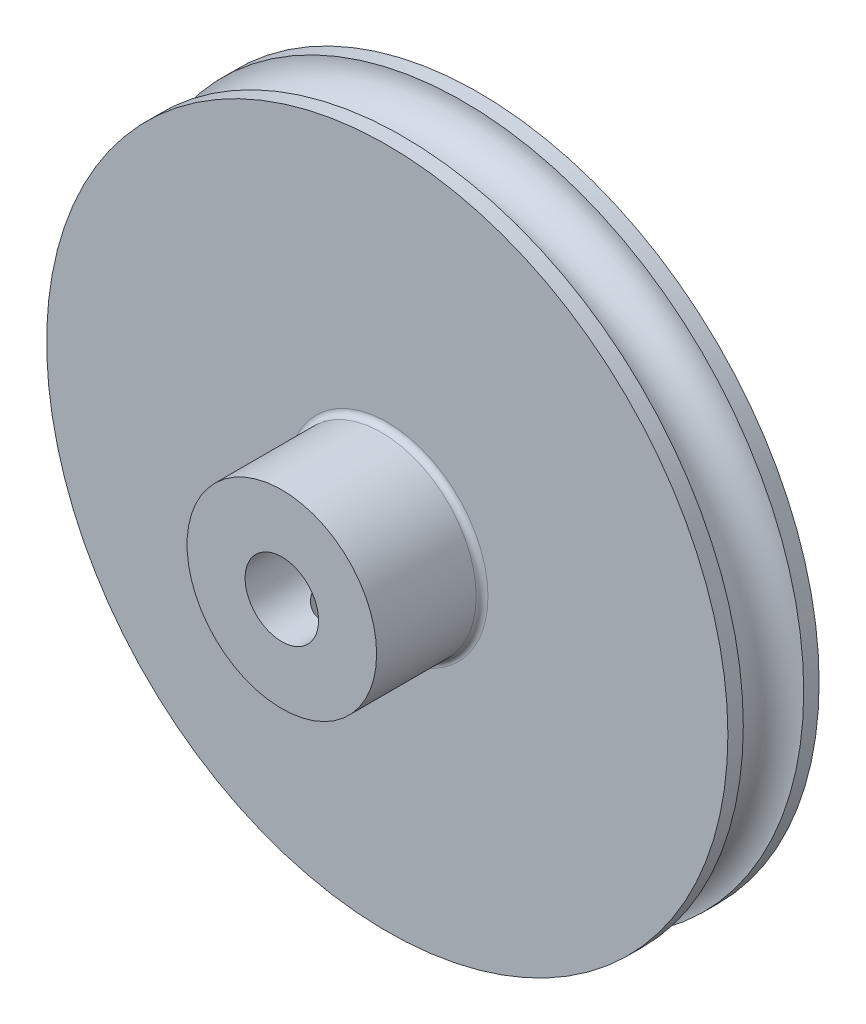
from build123d import *

# Parameters (mm, degrees)
SKETCH1_R           = 28.75
BOSS_EXTRUDE1_DEPTH = 3.85
SKETCH2_R           = 2.55
SKETCH4_R           = 8
BOSS_EXTRUDE2_DEPTH = 8.9
SKETCH5_R           = 3.1
CUT_EXTRUDE1_DEPTH  = 15.6
SKETCH6_R           = 2
CUT_EXTRUDE2_DEPTH  = 43.61088476
FILLET1_R           = 0.5


with BuildPart() as part:
    # Sketch1 → Boss-Extrude1 (new, symmetric)
    with BuildSketch(Plane.XY):
        with Locations(Location((0, 0, 0), (0, 0, 180))):
            Circle(SKETCH1_R)
    extrude(amount=BOSS_EXTRUDE1_DEPTH, both=True)

    # Cut-Sweep1: sweep along a curve in space
    with BuildLine() as cut_sweep1_path:
        ThreePointArc((28.75, 0, -3.85), (20.329319959, 20.329319959, -3.85), (0, 28.75, -3.85))
        ThreePointArc((0, 28.75, -3.85), (-20.329319959, 20.329319959, -3.85), (-28.75, 0, -3.85))
        ThreePointArc((-28.75, 0, -3.85), (-20.329319959, -20.329319959, -3.85), (0, -28.75, -3.85))
        ThreePointArc((0, -28.75, -3.85), (20.329319959, -20.329319959, -3.85), (28.75, 0, -3.85))
    # Sketch2 → Cut-Sweep1 (sweep, cut)
    with BuildSketch(Plane(origin=(0, 0, 0), x_dir=(1, 0, 0), z_dir=(0, 1, 0))):
        with Locations((28.75, 0)):
            Circle(SKETCH2_R)
    sweep(path=cut_sweep1_path.line, mode=Mode.SUBTRACT)

    # Sketch4 → Boss-Extrude2 (add)
    with BuildSketch(Plane.XY.offset(3.85)):
        Circle(SKETCH4_R)
    extrude(amount=BOSS_EXTRUDE2_DEPTH)

    # Sketch5 → Cut-Extrude1 (cut)
    with BuildSketch(Plane.XY.offset(12.75)):
        Circle(SKETCH5_R)
    extrude(amount=-CUT_EXTRUDE1_DEPTH, mode=Mode.SUBTRACT)

    # Sketch6 → Cut-Extrude2 (cut, through all)
    with BuildSketch(Plane(origin=(0, 0, 0), x_dir=(1, 0, 0), z_dir=(0, 1, 0))):
        with Locations(Location((0, -7.5, 0), (0, 0, 270))):
            Circle(SKETCH6_R)
    extrude(amount=-CUT_EXTRUDE2_DEPTH, mode=Mode.SUBTRACT)

    # Fillet1
    fillet1_edges = [part.edges().sort_by_distance(p)[0] for p in [
        (-8, 0, 3.85),
    ]]
    fillet(fillet1_edges, radius=FILLET1_R)


solid = part.part
